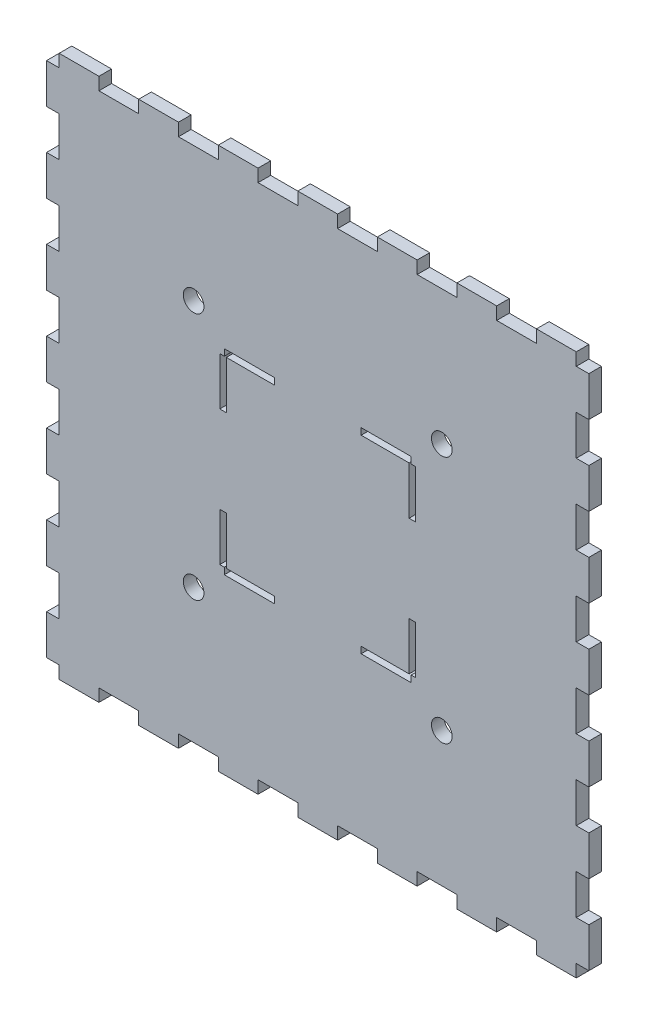
from build123d import *

# Parameters (mm, degrees)
SKETCH2_W           = 6.096
SKETCH2_H           = 19.230769231
SKETCH2_W_2         = 19.230769231
SKETCH2_H_2         = 6.096
SKETCH2_W_3         = 19.23076923
SKETCH2_H_3         = 19.23076923
BOSS_EXTRUDE2_DEPTH = 6.096
SKETCH3_R           = 5
CUT_EXTRUDE1_DEPTH  = 363.225735762


with BuildPart() as part:
    # Sketch2 → Boss-Extrude2 (new body)
    # profile 1 of 29: a face of its own
    with BuildSketch(Plane.XY):
        Polygon((0, 19.230769231), (0, 0), (19.230769231, 0), (38.461538462, 0), (57.692307692, 0), (76.923076923, 0), (96.153846154, 0), (115.384615385, 0), (134.615384615, 0), (153.846153846, 0), (173.076923077, 0), (192.307692308, 0), (211.538461538, 0), (230.769230769, 0), (250, 0), (250, 19.230769231), (250, 38.461538462), (250, 57.692307692), (250, 76.923076923), (250, 96.153846154), (250, 115.384615385), (250, 134.615384615), (250, 153.846153846), (250, 173.076923077), (250, 192.307692308), (250, 211.538461538), (250, 230.769230769), (250, 250), (230.769230769, 250), (211.538461538, 250), (192.307692308, 250), (173.076923077, 250), (153.846153846, 250), (134.615384615, 250), (115.384615385, 250), (96.153846154, 250), (76.923076923, 250), (57.692307692, 250), (38.461538462, 250), (19.230769231, 250), (0, 250), (0, 230.769230769), (0, 211.538461538), (0, 192.307692308), (0, 173.076923077), (0, 153.846153846), (0, 134.615384615), (0, 115.384615385), (0, 96.153846154), (0, 76.923076923), (0, 57.692307692), (0, 38.461538462), align=None)
        Polygon((80.825, 104), (80.825, 80.825), (104, 80.825), (104, 77.65), (80.825, 77.65), (79.825, 77.65), (79.825, 80.825), (77.65, 80.825), (77.65, 104), align=None, mode=Mode.SUBTRACT)
        Polygon((146, 80.825), (169.175, 80.825), (169.175, 104), (172.35, 104), (172.35, 80.825), (170.175, 80.825), (170.175, 77.65), (169.175, 77.65), (146, 77.65), align=None, mode=Mode.SUBTRACT)
        Polygon((104, 169.175), (80.825, 169.175), (80.825, 146), (77.65, 146), (77.65, 169.175), (79.825, 169.175), (79.825, 172.35), (80.825, 172.35), (104, 172.35), align=None, mode=Mode.SUBTRACT)
        Polygon((169.175, 146), (169.175, 169.175), (146, 169.175), (146, 172.35), (169.175, 172.35), (170.175, 172.35), (170.175, 169.175), (172.35, 169.175), (172.35, 146), align=None, mode=Mode.SUBTRACT)
    # profile 2 of 29: a face of its own
    with BuildSketch(Plane.XY):
        with Locations((-3.048, 9.615384616)):
            Rectangle(SKETCH2_W, SKETCH2_H)
    # profile 3 of 29: a face of its own
    with BuildSketch(Plane.XY):
        with Locations((9.615384616, -3.048)):
            Rectangle(SKETCH2_W_2, SKETCH2_H_2)
    # profile 4 of 29: a face of its own
    with BuildSketch(Plane.XY):
        with Locations((48.076923077, -3.048)):
            Rectangle(SKETCH2_W_3, SKETCH2_H_2)
    # profile 5 of 29: a face of its own
    with BuildSketch(Plane.XY):
        with Locations((-3.048, 48.076923077)):
            Rectangle(SKETCH2_W, SKETCH2_H_3)
    # profile 6 of 29: a face of its own
    with BuildSketch(Plane.XY):
        with Locations((86.538461539, -3.048)):
            Rectangle(SKETCH2_W_2, SKETCH2_H_2)
    # profile 7 of 29: a face of its own
    with BuildSketch(Plane.XY):
        with Locations((-3.048, 86.538461539)):
            Rectangle(SKETCH2_W, SKETCH2_H)
    # profile 8 of 29: a face of its own
    with BuildSketch(Plane.XY):
        with Locations((125, -3.048)):
            Rectangle(SKETCH2_W_3, SKETCH2_H_2)
    # profile 9 of 29: a face of its own
    with BuildSketch(Plane.XY):
        with Locations((-3.048, 125)):
            Rectangle(SKETCH2_W, SKETCH2_H_3)
    # profile 10 of 29: a face of its own
    with BuildSketch(Plane.XY):
        with Locations((163.461538462, -3.048)):
            Rectangle(SKETCH2_W_2, SKETCH2_H_2)
    # profile 11 of 29: a face of its own
    with BuildSketch(Plane.XY):
        with Locations((-3.048, 163.461538462)):
            Rectangle(SKETCH2_W, SKETCH2_H)
    # profile 12 of 29: a face of its own
    with BuildSketch(Plane.XY):
        with Locations((201.923076923, -3.048)):
            Rectangle(SKETCH2_W_3, SKETCH2_H_2)
    # profile 13 of 29: a face of its own
    with BuildSketch(Plane.XY):
        with Locations((-3.048, 201.923076923)):
            Rectangle(SKETCH2_W, SKETCH2_H_3)
    # profile 14 of 29: a face of its own
    with BuildSketch(Plane.XY):
        with Locations((240.384615385, -3.048)):
            Rectangle(SKETCH2_W_2, SKETCH2_H_2)
    # profile 15 of 29: a face of its own
    with BuildSketch(Plane.XY):
        with Locations((-3.048, 240.384615385)):
            Rectangle(SKETCH2_W, SKETCH2_H)
    # profile 16 of 29: a face of its own
    with BuildSketch(Plane.XY):
        with Locations((253.048, 9.615384616)):
            Rectangle(SKETCH2_W, SKETCH2_H)
    # profile 17 of 29: a face of its own
    with BuildSketch(Plane.XY):
        with Locations((9.615384616, 253.048)):
            Rectangle(SKETCH2_W_2, SKETCH2_H_2)
    # profile 18 of 29: a face of its own
    with BuildSketch(Plane.XY):
        with Locations((253.048, 48.076923077)):
            Rectangle(SKETCH2_W, SKETCH2_H_3)
    # profile 19 of 29: a face of its own
    with BuildSketch(Plane.XY):
        with Locations((48.076923077, 253.048)):
            Rectangle(SKETCH2_W_3, SKETCH2_H_2)
    # profile 20 of 29: a face of its own
    with BuildSketch(Plane.XY):
        with Locations((253.048, 86.538461539)):
            Rectangle(SKETCH2_W, SKETCH2_H)
    # profile 21 of 29: a face of its own
    with BuildSketch(Plane.XY):
        with Locations((86.538461539, 253.048)):
            Rectangle(SKETCH2_W_2, SKETCH2_H_2)
    # profile 22 of 29: a face of its own
    with BuildSketch(Plane.XY):
        with Locations((253.048, 125)):
            Rectangle(SKETCH2_W, SKETCH2_H_3)
    # profile 23 of 29: a face of its own
    with BuildSketch(Plane.XY):
        with Locations((125, 253.048)):
            Rectangle(SKETCH2_W_3, SKETCH2_H_2)
    # profile 24 of 29: a face of its own
    with BuildSketch(Plane.XY):
        with Locations((253.048, 163.461538462)):
            Rectangle(SKETCH2_W, SKETCH2_H)
    # profile 25 of 29: a face of its own
    with BuildSketch(Plane.XY):
        with Locations((163.461538462, 253.048)):
            Rectangle(SKETCH2_W_2, SKETCH2_H_2)
    # profile 26 of 29: a face of its own
    with BuildSketch(Plane.XY):
        with Locations((253.048, 201.923076923)):
            Rectangle(SKETCH2_W, SKETCH2_H_3)
    # profile 27 of 29: a face of its own
    with BuildSketch(Plane.XY):
        with Locations((201.923076923, 253.048)):
            Rectangle(SKETCH2_W_3, SKETCH2_H_2)
    # profile 28 of 29: a face of its own
    with BuildSketch(Plane.XY):
        with Locations((253.048, 240.384615385)):
            Rectangle(SKETCH2_W, SKETCH2_H)
    # profile 29 of 29: a face of its own
    with BuildSketch(Plane.XY):
        with Locations((240.384615385, 253.048)):
            Rectangle(SKETCH2_W_2, SKETCH2_H_2)
    extrude(amount=BOSS_EXTRUDE2_DEPTH)

    # Sketch3 → Cut-Extrude1 (cut, through all)
    with BuildSketch(Plane(origin=(0, 0, 0), x_dir=(-1, 0, 0), z_dir=(0, 0, -1))):
        with Locations((-185, 185)):
            Circle(SKETCH3_R)
        with Locations((-65, 185)):
            Circle(SKETCH3_R)
        with Locations((-65, 65)):
            Circle(SKETCH3_R)
        with Locations((-185, 65)):
            Circle(SKETCH3_R)
    extrude(amount=-CUT_EXTRUDE1_DEPTH, mode=Mode.SUBTRACT)


solid = part.part
